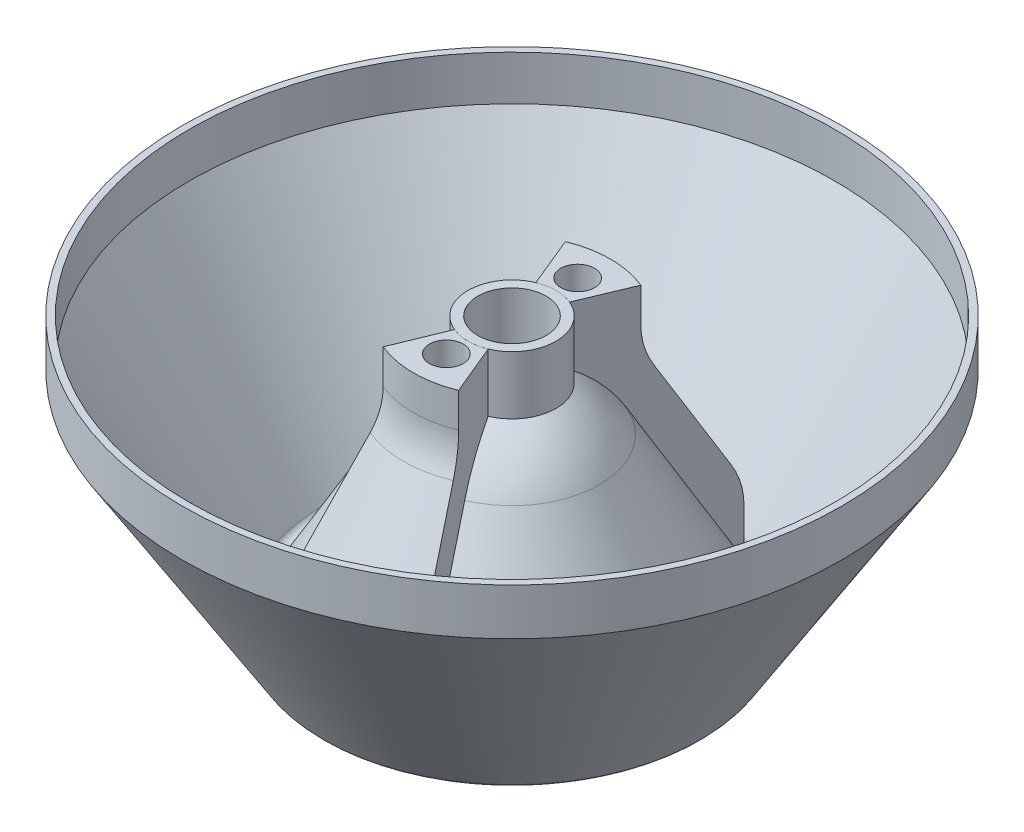
from build123d import *

# Parameters (mm, degrees)
REVOLVE9_ANGLE     = 45
CUT_REVOLVE4_ANGLE = 30
SKETCH11_R         = 2.5
CUT_EXTRUDE1_DEPTH = 10
CIRPATTERN12_COUNT = 2
CIRPATTERN12_ANGLE = 180


with BuildPart() as part:
    # Sketch1 → Revolve7 (revolve)
    with BuildSketch(Plane(origin=(0, 0, 0), x_dir=(0, 0, -1), z_dir=(1, 0, 0))):
        with BuildLine():
            Line((-48.728965868, 20.832969512), (-48.728965868, 13.935351474))
            Line((-48.728965868, 13.935351474), (-27.921225233, -19.419545618))
            ThreePointArc((-27.921225233, -19.419545618), (-27.055647383, -19.89011474), (-26.206700037, -19.390166026))
            Line((-26.206700037, -19.390166026), (-12.042822977, 5.148637149))
            ThreePointArc((-12.042822977, 5.148637149), (-9.022213685, 9.01536435), (-5.052546128, 11.89935451))
            Line((-5.052546128, 11.89935451), (-5.052546128, 20.832969512))
            Line((-5.052546128, 20.832969512), (-6.502327374, 20.832969512))
            Line((-6.502327374, 20.832969512), (-6.502327374, 12.22238818))
            ThreePointArc((-6.502327374, 12.22238818), (-10.117005004, 9.336386742), (-12.908903509, 5.648541651))
            Line((-12.908903509, 5.648541651), (-26.239989701, -17.447458038))
            ThreePointArc((-26.239989701, -17.447458038), (-27.088937047, -17.947406752), (-27.954514897, -17.47683763))
            Line((-27.954514897, -17.47683763), (-47.728965868, 14.221691717))
            Line((-47.728965868, 14.221691717), (-47.728965868, 20.832969512))
            Line((-47.728965868, 20.832969512), (-48.728965868, 20.832969512))
        make_face()
    revolve(axis=Axis((0, 0, 0), (0, -1, 0)))


with BuildPart() as body_2:
    # Sketch4 → Revolve9 (revolve, symmetric)
    with BuildSketch(Plane(origin=(0, 0, 0), x_dir=(0, 0, -1), z_dir=(1, 0, 0))) as revolve9_sk:
        with BuildLine():
            Line((-26.239989701, -17.447458038), (-26.239989701, -10.392338827))
            ThreePointArc((-26.239989701, -10.392338827), (-25.865330741, -7.545915144), (-24.766875558, -4.893389303))
            Line((-24.766875558, -4.893389303), (-16.043683511, 10.219470812))
            ThreePointArc((-16.043683511, 10.219470812), (-14.945228328, 12.871996653), (-14.570569368, 15.718420336))
            Line((-14.570569368, 15.718420336), (-14.570569368, 20.807254449))
            Line((-14.570569368, 20.807254449), (-6.502327374, 20.832969512))
            Line((-6.502327374, 20.832969512), (-6.502327374, 12.22238818))
            ThreePointArc((-6.502327374, 12.22238818), (-10.117005004, 9.336386742), (-12.908903509, 5.648541651))
            Line((-12.908903509, 5.648541651), (-26.239989701, -17.447458038))
        make_face()
    revolve(axis=Axis((0, 0, 0), (0, -1, 0)), revolution_arc=REVOLVE9_ANGLE / 2)
    revolve(revolve9_sk.sketch, axis=Axis((0, 0, 0), (0, 1, 0)), revolution_arc=REVOLVE9_ANGLE / 2)

    # Sketch6 → Cut-Revolve4 (revolve, symmetric, cut)
    with BuildSketch(Plane(origin=(0, 0, 0), x_dir=(0, 0, -1), z_dir=(1, 0, 0))) as cut_revolve4_sk:
        with BuildLine():
            Line((-23.900795026, -5.393293805), (-15.177602979, 9.71956631))
            ThreePointArc((-15.177602979, 9.71956631), (-14.394768906, 11.347895879), (-13.865275202, 13.075299362))
            Line((-13.865275202, 13.075299362), (-7.024383421, 13.075299362))
            ThreePointArc((-7.024383421, 13.075299362), (-10.833164358, 10.034323544), (-13.774984042, 6.148446154))
            Line((-13.774984042, 6.148446154), (-25.239989701, -13.714584011))
            Line((-25.239989701, -13.714584011), (-25.239989701, -10.392338827))
            ThreePointArc((-25.239989701, -10.392338827), (-24.899390647, -7.804680933), (-23.900795026, -5.393293805))
        make_face()
    revolve(axis=Axis((0, 0, 0), (0, -1, 0)), revolution_arc=CUT_REVOLVE4_ANGLE / 2, mode=Mode.SUBTRACT)
    revolve(cut_revolve4_sk.sketch, axis=Axis((0, 0, 0), (0, 1, 0)), revolution_arc=CUT_REVOLVE4_ANGLE / 2, mode=Mode.SUBTRACT)

    # Sketch11 → Cut-Extrude1 (cut)
    with BuildSketch(Plane.XZ.offset(-13.075299362)):
        with Locations(Location((0, 9.705615441, 0), (0, 0, 270))):
            Circle(SKETCH11_R)
    extrude(amount=-CUT_EXTRUDE1_DEPTH, mode=Mode.SUBTRACT)


with BuildPart() as cirpattern12_1:
    # CirPattern12: pattern copy
    add(body_2.part.rotate(Axis((0, 0, 0), (0, 1, 0)), 1 * CIRPATTERN12_ANGLE / (CIRPATTERN12_COUNT - 1)))


solid = Compound([part.part, body_2.part, cirpattern12_1.part])
